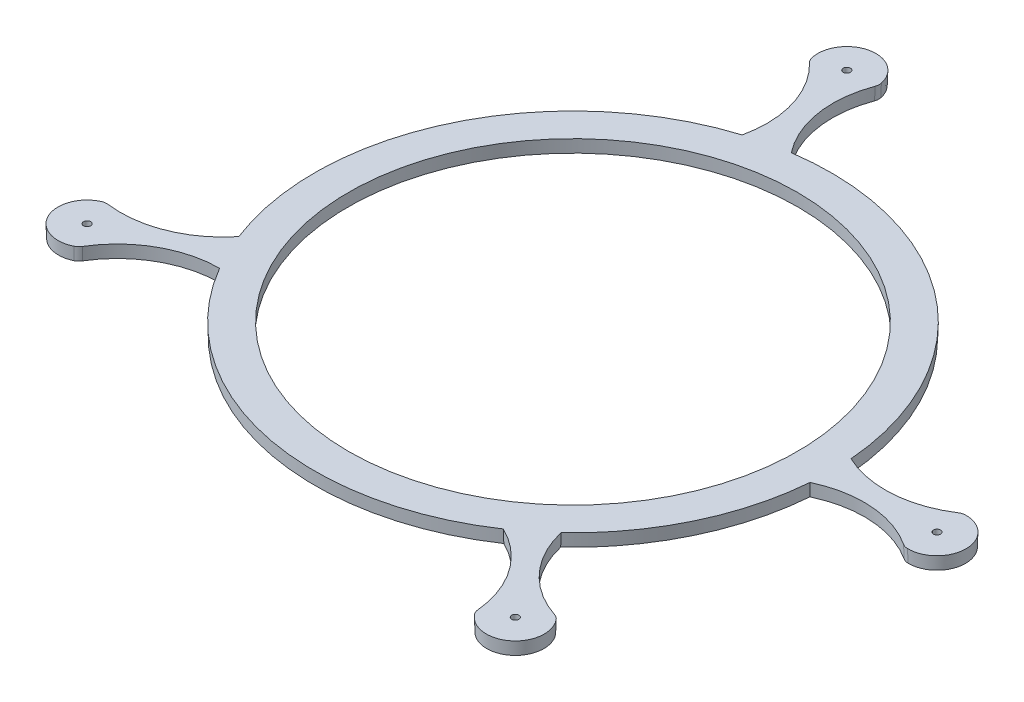
from build123d import *

# Parameters (mm, degrees)
SKETCH1_R                      = 63.5
SKETCH1_R_2                    = 55.372
BOSS_EXTRUDE1_DEPTH            = 3.175
BOSS_EXTRUDE2_DEPTH            = 3.175
SKETCH37_R                     = 0.889
CUT_EXTRUDE19_DEPTH            = 116.700962847
DRAFT20_ANGLE                  = 2
DRAFT21_ANGLE                  = 2
CIRPATTERN7_COUNT              = 7
DRAFT21_OF_CIRPATTERN7_2_ANGLE = 2
DRAFT21_OF_CIRPATTERN7_3_ANGLE = 2
DRAFT21_OF_CIRPATTERN7_4_ANGLE = 2


with BuildPart() as part:
    # Sketch1 → Boss-Extrude1 (new body)
    with BuildSketch(Plane(origin=(0, 0, 0), x_dir=(1, 0, 0), z_dir=(0, 1, 0))):
        with Locations(Location((0, 0, 0), (0, 0, 270))):
            Circle(SKETCH1_R)
        with Locations(Location((0, 0, 0), (0, 0, 270))):
            Circle(SKETCH1_R_2, mode=Mode.SUBTRACT)
    extrude(amount=BOSS_EXTRUDE1_DEPTH)

    # Sketch2 → Boss-Extrude2 (add)
    with BuildSketch(Plane(origin=(0, 0, 0), x_dir=(1, 0, 0), z_dir=(0, 1, 0))):
        with BuildLine():
            ThreePointArc((63.304250692, -4.982152579), (63.5, 0), (63.304250692, 4.982152579))
            ThreePointArc((63.304250692, 4.982152579), (75.956520603, 2.543628775), (88.177394932, 6.627323532))
            ThreePointArc((88.177394932, 6.627323532), (88.826525295, 6.930865115), (89.534602282, 7.04102274))
            ThreePointArc((89.534602282, 7.04102274), (96.666344602, 0), (89.534602282, -7.04102274))
            ThreePointArc((89.534602282, -7.04102274), (88.826525295, -6.930865115), (88.177394932, -6.627323532))
            ThreePointArc((88.177394932, -6.627323532), (75.956520603, -2.543628775), (63.304250692, -4.982152579))
        make_face()
    boss_extrude2 = extrude(amount=BOSS_EXTRUDE2_DEPTH)

    # Sketch37 → Cut-Extrude19 (cut, through all)
    with BuildSketch(Plane(origin=(0, 3.175, 0), x_dir=(1, 0, 0), z_dir=(0, 1, 0))):
        with Locations(Location((89.624744861, 0, 0), (0, 0, 270))):
            Circle(SKETCH37_R)
    cut_extrude19 = extrude(amount=-CUT_EXTRUDE19_DEPTH, mode=Mode.SUBTRACT)

    # Draft20
    draft20_faces = [part.faces().sort_by_distance(p)[0] for p in [
        (0, 1.5875, -55.372),
        (-63.5, 1.5875, 0),
    ]]
    draft(draft20_faces, Plane(origin=(0, 0, 0), x_dir=(0, 0, -1), z_dir=(0, -1, 0)), DRAFT20_ANGLE)

    # Draft21
    draft21_faces = [part.faces().sort_by_distance(p)[0] for p in [
        (88.826525295, 1.5875, 6.930865115),
        (75.956520603, 1.587499999, 2.543628775),
        (88.826525295, 1.5875, -6.930865115),
        (96.666344602, 1.5875, 0),
        (75.956520603, 1.5875, -2.543628775),
    ]]
    draft(draft21_faces, Plane(origin=(0, 0, 0), x_dir=(0, 0, -1), z_dir=(0, -1, 0)), DRAFT21_ANGLE)

    # CirPattern7: Boss-Extrude2, Cut-Extrude19 ×7 about axis, 3 skipped
    cirpattern7_axis = Axis((0, 0, 0), (0, -1, 0))
    add([boss_extrude2.rotate(cirpattern7_axis, i * 360 / CIRPATTERN7_COUNT) for i in range(1, CIRPATTERN7_COUNT) if i not in (2, 4, 6)])
    add([cut_extrude19.rotate(cirpattern7_axis, i * 360 / CIRPATTERN7_COUNT) for i in range(1, CIRPATTERN7_COUNT) if i not in (2, 4, 6)], mode=Mode.SUBTRACT)

    # Draft21 of CirPattern7 2
    draft21_of_cirpattern7_2_faces = [part.faces().sort_by_distance(p)[0] for p in [
        (49.963664108, 1.5875, 73.768697671),
        (45.369426924, 1.587499999, 60.971125707),
        (60.801201204, 1.5875, 65.126050237),
        (60.270480042, 1.5875, 75.576791505),
        (49.346805037, 1.5875, 57.799272505),
    ]]
    draft(draft21_of_cirpattern7_2_faces, Plane(origin=(0, 0, 0), x_dir=(0.7818314824680298, 0, -0.6234898018587336), z_dir=(0, -1, 0)), DRAFT21_OF_CIRPATTERN7_2_ANGLE)

    # Draft21 of CirPattern7 3
    draft21_of_cirpattern7_3_faces = [part.faces().sort_by_distance(p)[0] for p in [
        (-83.037123606, 1.5875, 32.295891232),
        (-69.538099541, 1.587499999, 30.664568831),
        (-77.022744263, 1.5875, 44.784878624),
        (-87.09336706, 1.5875, 41.941955043),
        (-67.330821213, 1.5875, 35.248029508),
    ]]
    draft(draft21_of_cirpattern7_3_faces, Plane(origin=(0, 0, 0), x_dir=(0.43388373911755823, 0, 0.900968867902419), z_dir=(0, -1, 0)), DRAFT21_OF_CIRPATTERN7_3_ANGLE)

    # Draft21 of CirPattern7 4
    draft21_of_cirpattern7_4_faces = [part.faces().sort_by_distance(p)[0] for p in [
        (-13.008667512, 1.5875, -88.141721431),
        (-14.422061213, 1.587499999, -74.618142699),
        (-26.522855225, 1.5875, -85.057196274),
        (-21.510285283, 1.5875, -94.242717521),
        (-19.381770596, 1.5875, -73.486121397),
    ]]
    draft(draft21_of_cirpattern7_4_faces, Plane(origin=(0, 0, 0), x_dir=(-0.9749279121818237, 0, 0.2225209339563137), z_dir=(0, -1, 0)), DRAFT21_OF_CIRPATTERN7_4_ANGLE)


solid = part.part
